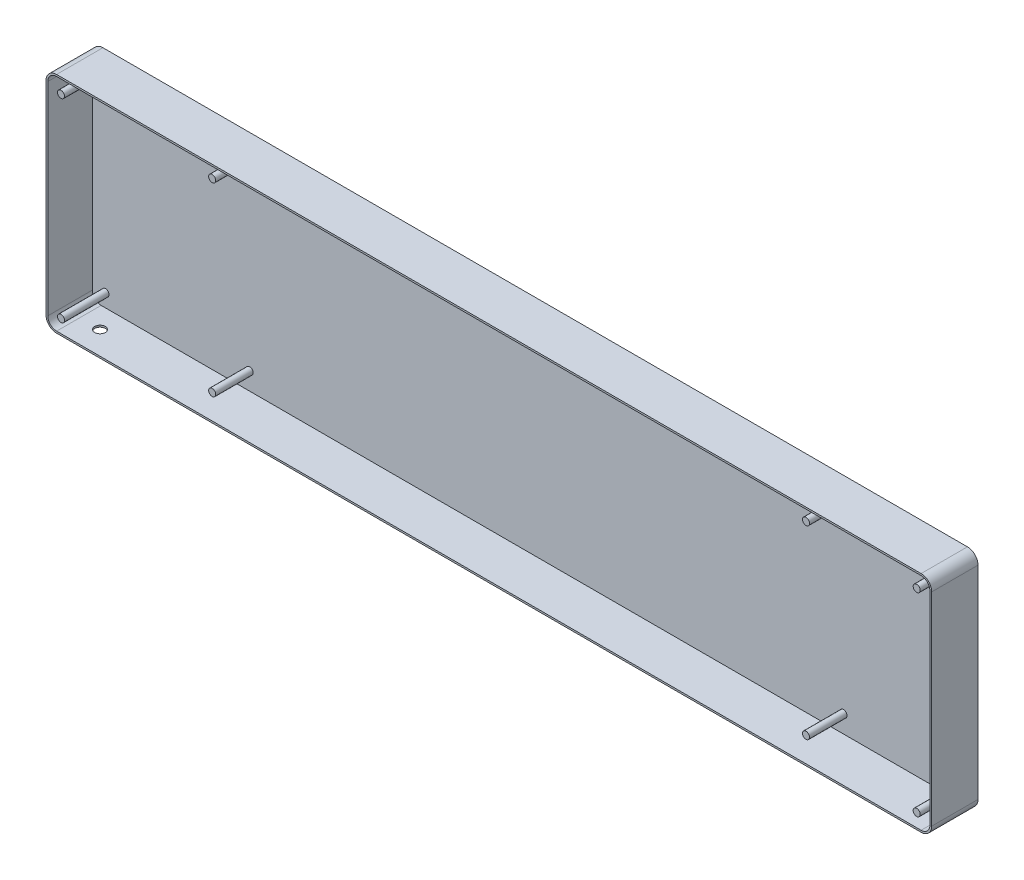
from build123d import *

# Parameters (mm, degrees)
BOSS_EXTRU_1_DEPTH      = 50.5
BOSS_EXTRU_2_DEPTH      = 2
ESQUISSE6_R             = 4
BOSS_EXTRU_4_DEPTH      = 50.5
ESQUISSE7_R             = 4
BOSS_EXTRU_5_DEPTH      = 42.5
ESQUISSE8_R             = 6
ENL_V_MAT_EXTRU_1_DEPTH = 2


with BuildPart() as part:
    # Esquisse2 → Boss.-Extru.1 (new body)
    with BuildSketch(Plane.XY):
        with BuildLine():
            Line((694.77885805, 135.537159381), (-285.22114195, 135.537159381))
            ThreePointArc((-285.22114195, 135.537159381), (-293.706423325, 132.022440755), (-297.22114195, 123.537159381))
            Line((-297.22114195, 123.537159381), (-297.22114195, -106.462840619))
            ThreePointArc((-297.22114195, -106.462840619), (-293.706423325, -114.948121993), (-285.22114195, -118.462840619))
            Line((-285.22114195, -118.462840619), (694.77885805, -118.462840619))
            ThreePointArc((694.77885805, -118.462840619), (703.264139424, -114.948121993), (706.77885805, -106.462840619))
            Line((706.77885805, -106.462840619), (706.77885805, 123.537159381))
            ThreePointArc((706.77885805, 123.537159381), (703.264139424, 132.022440755), (694.77885805, 135.537159381))
        make_face()
        with BuildLine():
            Line((-295.22114195, 123.537159381), (-295.22114195, -106.462840619))
            ThreePointArc((-295.22114195, -106.462840619), (-292.292209762, -113.533908431), (-285.22114195, -116.462840619))
            Line((-285.22114195, -116.462840619), (694.77885805, -116.462840619))
            ThreePointArc((694.77885805, -116.462840619), (701.849925862, -113.533908431), (704.77885805, -106.462840619))
            Line((704.77885805, -106.462840619), (704.77885805, 123.537159381))
            ThreePointArc((704.77885805, 123.537159381), (701.849925862, 130.608227193), (694.77885805, 133.537159381))
            Line((694.77885805, 133.537159381), (-285.22114195, 133.537159381))
            ThreePointArc((-285.22114195, 133.537159381), (-292.292209762, 130.608227193), (-295.22114195, 123.537159381))
        make_face(mode=Mode.SUBTRACT)
    extrude(amount=-BOSS_EXTRU_1_DEPTH)

    # Esquisse4 → Boss.-Extru.2 (add)
    with BuildSketch(Plane(origin=(0, 0, -50.5), x_dir=(-1, 0, 0), z_dir=(0, 0, -1))):
        with BuildLine():
            Line((297.22114195, 123.537159381), (297.22114195, -106.462840619))
            ThreePointArc((297.22114195, -106.462840619), (293.706423325, -114.948121993), (285.22114195, -118.462840619))
            Line((285.22114195, -118.462840619), (-694.77885805, -118.462840619))
            ThreePointArc((-694.77885805, -118.462840619), (-703.264139424, -114.948121993), (-706.77885805, -106.462840619))
            Line((-706.77885805, -106.462840619), (-706.77885805, 123.537159381))
            ThreePointArc((-706.77885805, 123.537159381), (-703.264139424, 132.022440755), (-694.77885805, 135.537159381))
            Line((-694.77885805, 135.537159381), (285.22114195, 135.537159381))
            ThreePointArc((285.22114195, 135.537159381), (293.706423325, 132.022440755), (297.22114195, 123.537159381))
        make_face()
    extrude(amount=BOSS_EXTRU_2_DEPTH)

    # Esquisse6 → Boss.-Extru.4 (add)
    with BuildSketch(Plane.XY.offset(-50.5)):
        with Locations(Location((-280.22114195, 118.537159381, 0), (0, 0, 180))):
            Circle(ESQUISSE6_R)
        with Locations(Location((-280.22114195, -101.462840619, 0), (0, 0, 180))):
            Circle(ESQUISSE6_R)
        with Locations(Location((689.77885805, -101.462840619, 0), (0, 0, 180))):
            Circle(ESQUISSE6_R)
        with Locations(Location((689.77885805, 118.537159381, 0), (0, 0, 180))):
            Circle(ESQUISSE6_R)
    extrude(amount=BOSS_EXTRU_4_DEPTH)

    # Esquisse7 → Boss.-Extru.5 (add)
    with BuildSketch(Plane.XY.offset(-50.5)):
        with Locations(Location((-116.842462294, 113.537159381, 0), (0, 0, 180))):
            Circle(ESQUISSE7_R)
        with Locations(Location((-116.842462294, -96.462840619, 0), (0, 0, 180))):
            Circle(ESQUISSE7_R)
        with Locations(Location((556.289518221, 113.537159381, 0), (0, 0, 180))):
            Circle(ESQUISSE7_R)
        with Locations(Location((556.289518221, -96.462840619, 0), (0, 0, 180))):
            Circle(ESQUISSE7_R)
    extrude(amount=BOSS_EXTRU_5_DEPTH)

    # Esquisse8 → Enlèv. mat.-Extru.1 (cut)
    with BuildSketch(Plane(origin=(0, -118.462840619, 0), x_dir=(-1, 0, 0), z_dir=(0, -1, 0))):
        with Locations(Location((262.22114195, 26.25, 0), (0, 0, 90))):
            Circle(ESQUISSE8_R)
    extrude(amount=-ENL_V_MAT_EXTRU_1_DEPTH, mode=Mode.SUBTRACT)


solid = part.part
